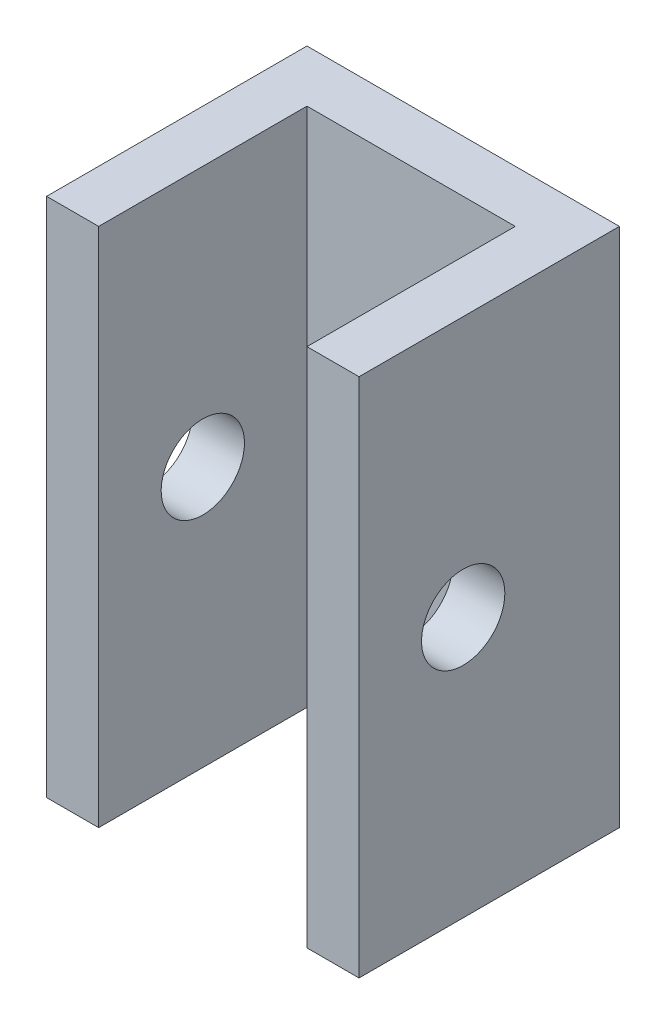
from build123d import *

# Parameters (mm, degrees)
SKETCH1_W           = 30
SKETCH1_H           = 50
BOSS_EXTRUDE1_DEPTH = 5
SKETCH2_W           = 5
SKETCH2_H           = 50
BOSS_EXTRUDE2_DEPTH = 20
SKETCH3_R           = 4
CUT_EXTRUDE1_DEPTH  = 47.368092477


with BuildPart() as part:
    # Sketch1 → Boss-Extrude1 (new body)
    with BuildSketch(Plane.XY):
        Rectangle(SKETCH1_W, SKETCH1_H)
    extrude(amount=BOSS_EXTRUDE1_DEPTH)

    # Sketch2 → Boss-Extrude2 (add)
    with BuildSketch(Plane.XY.offset(5)):
        with Locations((-12.5, 0)):
            Rectangle(SKETCH2_W, SKETCH2_H)
        with Locations((12.5, 0)):
            Rectangle(SKETCH2_W, SKETCH2_H)
    extrude(amount=BOSS_EXTRUDE2_DEPTH)

    # Sketch3 → Cut-Extrude1 (cut, through all)
    with BuildSketch(Plane(origin=(15, 0, 0), x_dir=(0, 0, -1), z_dir=(1, 0, 0))):
        with Locations((-15, 0)):
            Circle(SKETCH3_R)
    extrude(amount=-CUT_EXTRUDE1_DEPTH, mode=Mode.SUBTRACT)


solid = part.part
